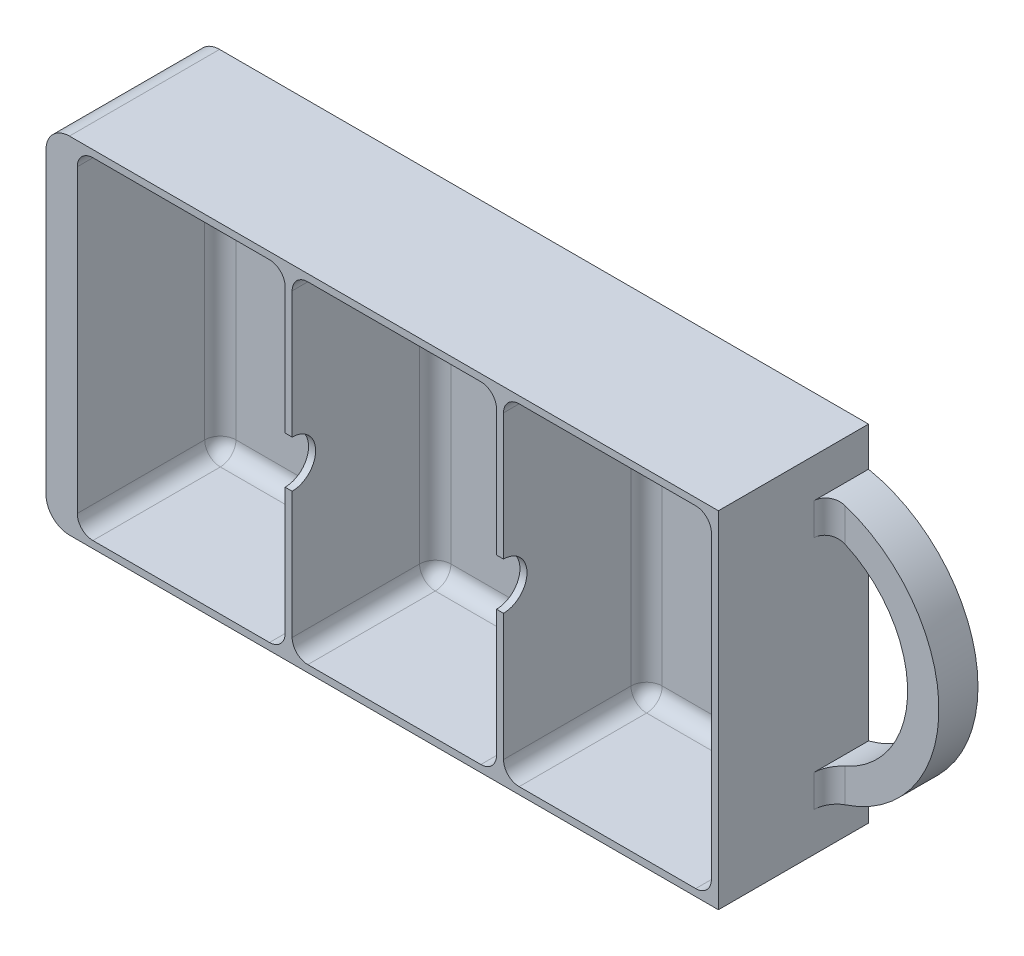
from build123d import *

# Parameters (mm, degrees)
SKETCH_1_W                  = 86
SKETCH_1_H                  = 44.2
EXTRUDE_1_DEPTH             = 14.2
EXTRUDE_2_DEPTH             = 5
SKETCH_3_W                  = 26.584
SKETCH_3_H                  = 42.4
CUT_EXTRUDE_1_DEPTH         = 18.3
SKETCH_4_W                  = 26.583
SKETCH_4_H                  = 42.4
CUT_EXTRUDE_2_DEPTH         = 18.3
SKETCH_5_W                  = 26.133
SKETCH_5_H                  = 42.4
CUT_EXTRUDE_3_DEPTH         = 18.3
HOLE_WIZARD_8_3_8_3_1_D     = 8.3
HOLE_WIZARD_8_3_8_3_1_DEPTH = 3.2
HOLE_WIZARD_6_0_6_1_D       = 6
HOLE_WIZARD_6_0_6_1_DEPTH   = 0.9
HOLE_WIZARD_6_0_6_2_D       = 6
HOLE_WIZARD_6_0_6_2_DEPTH   = 0.9
FILLET_1_R                  = 3
EXTRUDE_START               = -3.5
SKETCH_12_R                 = 4.15
EXTRUDE_3_DEPTH             = 3.5
FILLET_2_R                  = 2


with BuildPart() as part:
    # Эскиз1 → Бобышка-Вытянуть1 (new body)
    with BuildSketch(Plane.XY.offset(9.6)):
        with Locations((47, 0)):
            Rectangle(SKETCH_1_W, SKETCH_1_H)
    extrude(amount=-EXTRUDE_1_DEPTH)

    # Эскиз2 → Бобышка-Вытянуть2 (add)
    with BuildSketch(Plane(origin=(0, 0, -4.6), x_dir=(-1, 0, 0), z_dir=(0, 0, -1))):
        with BuildLine():
            Line((-90, -22.1), (-90, -17.1))
            ThreePointArc((-90, -17.1), (-104, 0), (-90, 17.1))
            Line((-90, 17.1), (-90, 22.1))
            Line((-90, 22.1), (-4, 22.1))
            Line((-4, 22.1), (-4, -22.1))
            Line((-4, -22.1), (-90, -22.1))
        make_face()
        with BuildLine():
            Line((-90, -12.994779171), (-90, 12.994779171))
            ThreePointArc((-90, 12.994779171), (-100, 0), (-90, -12.994779171))
        make_face(mode=Mode.SUBTRACT)
    extrude(amount=EXTRUDE_2_DEPTH)

    # Эскиз3 → Вырез-Вытянуть1 (cut)
    with BuildSketch(Plane.XY.offset(9.6)):
        with Locations((75.808, 0)):
            Rectangle(SKETCH_3_W, SKETCH_3_H)
    extrude(amount=-CUT_EXTRUDE_1_DEPTH, mode=Mode.SUBTRACT)

    # Эскиз4 → Вырез-Вытянуть2 (cut)
    with BuildSketch(Plane.XY.offset(9.6)):
        with Locations((21.2915, 0)):
            Rectangle(SKETCH_4_W, SKETCH_4_H)
    extrude(amount=-CUT_EXTRUDE_2_DEPTH, mode=Mode.SUBTRACT)

    # Эскиз5 → Вырез-Вытянуть3 (cut)
    with BuildSketch(Plane.XY.offset(9.6)):
        with Locations((48.5495, 0)):
            Rectangle(SKETCH_5_W, SKETCH_5_H)
    extrude(amount=-CUT_EXTRUDE_3_DEPTH, mode=Mode.SUBTRACT)

    # Диаметр отверстия Ø8.3 (8.3)1
    with Locations(Plane.ZY.offset(-4)):
        with Locations((0, 0)):
            Hole(HOLE_WIZARD_8_3_8_3_1_D / 2, depth=HOLE_WIZARD_8_3_8_3_1_DEPTH)

    # Диаметр отверстия Ø6.0 (6)1
    with Locations(Plane.ZY.offset(-61.616)):
        with Locations((9.6, 0)):
            Hole(HOLE_WIZARD_6_0_6_1_D / 2, depth=HOLE_WIZARD_6_0_6_1_DEPTH)

    # Диаметр отверстия Ø6.0 (6)2
    with Locations(Plane(origin=(35.483, 0, 0), x_dir=(0, 0, -1), z_dir=(1, 0, 0))):
        with Locations((-9.6, 0)):
            Hole(HOLE_WIZARD_6_0_6_2_D / 2, depth=HOLE_WIZARD_6_0_6_2_DEPTH)

    # Скругление1
    fillet_1_edges = [part.edges().sort_by_distance(p)[0] for p in [
        (4, -22.1, 0),
        (4, 22.1, 0),
    ]]
    fillet(fillet_1_edges, radius=FILLET_1_R)

    # Эскиз12 → Бобышка-Вытянуть3 (add)
    with BuildSketch(Plane.ZY.offset(-4).offset(EXTRUDE_START)):
        Circle(SKETCH_12_R)
    extrude(amount=EXTRUDE_3_DEPTH)

    # Скругление2
    fillet_2_edges = [part.edges().sort_by_distance(p)[0] for p in [
        (90, -15.047389586, -4.6),
        (90, 15.047389586, -4.6),
        (75.808, 21.2, -8.7),
        (62.516, 21.2, 0.45),
        (89.1, 0, -8.7),
        (89.1, 21.2, 0.45),
        (75.808, -21.2, -8.7),
        (89.1, -21.2, 0.45),
        (62.516, 0, -8.7),
        (62.516, -21.2, 0.45),
        (21.2915, 21.2, -8.7),
        (8, 21.2, 0.45),
        (34.583, 0, -8.7),
        (34.583, 21.2, 0.45),
        (21.2915, -21.2, -8.7),
        (34.583, -21.2, 0.45),
        (8, 0, -8.7),
        (8, -21.2, 0.45),
        (48.5495, -21.2, -8.7),
        (61.616, -21.2, 0.45),
        (35.483, 0, -8.7),
        (35.483, -21.2, 0.45),
        (48.5495, 21.2, -8.7),
        (35.483, 21.2, 0.45),
        (61.616, 0, -8.7),
        (61.616, 21.2, 0.45),
    ]]
    fillet(fillet_2_edges, radius=FILLET_2_R)


solid = part.part
